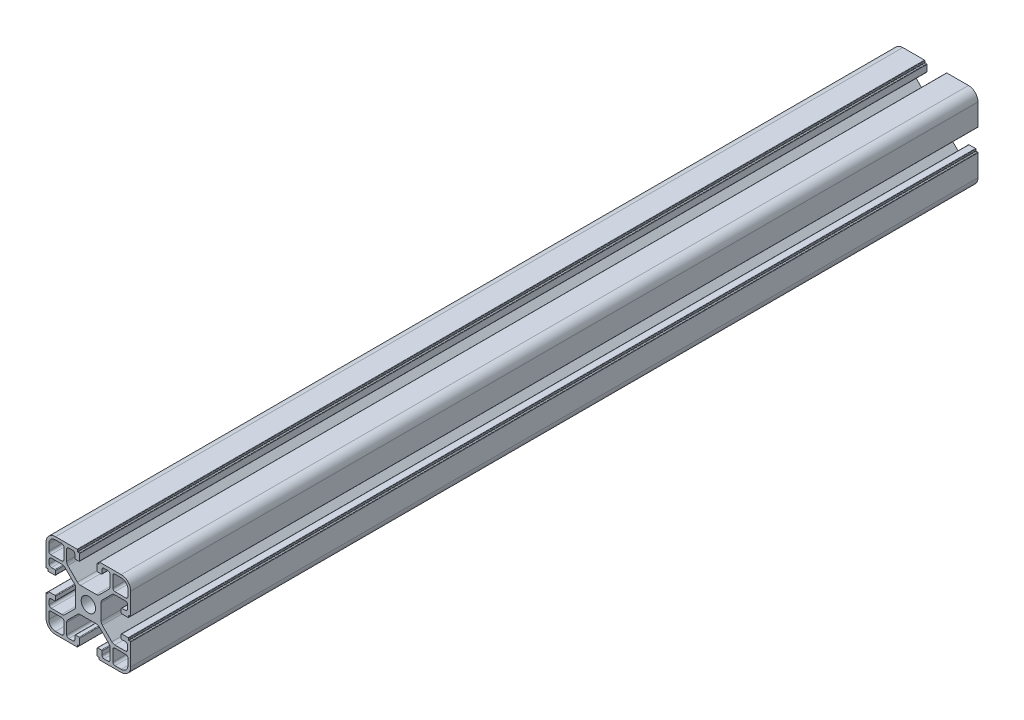
from build123d import *

# Parameters (mm, degrees)
SKETCH2_R           = 3.4
BOSS_EXTRUDE1_DEPTH = 400


with BuildPart() as part:
    # Sketch2 → Boss-Extrude1 (new body)
    with BuildSketch(Plane.XY):
        with BuildLine():
            Line((4.5, 0), (14.7, 0))
            ThreePointArc((14.7, 0), (14.841421356, 0.058578644), (14.9, 0.2))
            Line((14.9, 0.2), (14.9, 0.8))
            ThreePointArc((14.9, 0.8), (14.958578644, 0.941421356), (15.1, 1))
            Line((15.1, 1), (15.7, 1))
            ThreePointArc((15.7, 1), (15.841421356, 1.058578644), (15.9, 1.2))
            Line((15.9, 1.2), (15.9, 4.2))
            ThreePointArc((15.9, 4.2), (15.812132034, 4.412132034), (15.6, 4.5))
            Line((15.6, 4.5), (13.9, 4.5))
            ThreePointArc((13.9, 4.5), (13.687867966, 4.412132034), (13.6, 4.2))
            Line((13.6, 4.2), (13.6, 2.5))
            ThreePointArc((13.6, 2.5), (13.307106781, 1.792893219), (12.6, 1.5))
            Line((12.6, 1.5), (10.75, 1.5))
            ThreePointArc((10.75, 1.5), (10.042893219, 1.792893219), (9.75, 2.5))
            Line((9.75, 2.5), (9.75, 7.507359313))
            ThreePointArc((9.75, 7.507359313), (9.902240935, 8.272726178), (10.335786438, 8.921572875))
            Line((10.335786438, 8.921572875), (14.828427125, 13.414213562))
            ThreePointArc((14.828427125, 13.414213562), (15.477273822, 13.847759065), (16.242640687, 14))
            Line((16.242640687, 14), (23.757359313, 14))
            ThreePointArc((23.757359313, 14), (24.522726178, 13.847759065), (25.171572875, 13.414213562))
            Line((25.171572875, 13.414213562), (29.664213562, 8.921572875))
            ThreePointArc((29.664213562, 8.921572875), (30.097759065, 8.272726178), (30.25, 7.507359313))
            Line((30.25, 7.507359313), (30.25, 2.5))
            ThreePointArc((30.25, 2.5), (29.957106781, 1.792893219), (29.25, 1.5))
            Line((29.25, 1.5), (27.4, 1.5))
            ThreePointArc((27.4, 1.5), (26.692893219, 1.792893219), (26.4, 2.5))
            Line((26.4, 2.5), (26.4, 4.2))
            ThreePointArc((26.4, 4.2), (26.312132034, 4.412132034), (26.1, 4.5))
            Line((26.1, 4.5), (24.4, 4.5))
            ThreePointArc((24.4, 4.5), (24.187867966, 4.412132034), (24.1, 4.2))
            Line((24.1, 4.2), (24.1, 1.2))
            ThreePointArc((24.1, 1.2), (24.158578644, 1.058578644), (24.3, 1))
            Line((24.3, 1), (24.9, 1))
            ThreePointArc((24.9, 1), (25.041421356, 0.941421356), (25.1, 0.8))
            Line((25.1, 0.8), (25.1, 0.2))
            ThreePointArc((25.1, 0.2), (25.158578644, 0.058578644), (25.3, 0))
            Line((25.3, 0), (35.5, 0))
            ThreePointArc((35.5, 0), (38.681980515, 1.318019485), (40, 4.5))
            Line((40, 4.5), (40, 14.7))
            ThreePointArc((40, 14.7), (39.941421356, 14.841421356), (39.8, 14.9))
            Line((39.8, 14.9), (39.2, 14.9))
            ThreePointArc((39.2, 14.9), (39.058578644, 14.958578644), (39, 15.1))
            Line((39, 15.1), (39, 15.7))
            ThreePointArc((39, 15.7), (38.941421356, 15.841421356), (38.8, 15.9))
            Line((38.8, 15.9), (35.8, 15.9))
            ThreePointArc((35.8, 15.9), (35.587867966, 15.812132034), (35.5, 15.6))
            Line((35.5, 15.6), (35.5, 13.9))
            ThreePointArc((35.5, 13.9), (35.587867966, 13.687867966), (35.8, 13.6))
            Line((35.8, 13.6), (37.5, 13.6))
            ThreePointArc((37.5, 13.6), (38.207106781, 13.307106781), (38.5, 12.6))
            Line((38.5, 12.6), (38.5, 10.75))
            ThreePointArc((38.5, 10.75), (38.207106781, 10.042893219), (37.5, 9.75))
            Line((37.5, 9.75), (32.492640687, 9.75))
            ThreePointArc((32.492640687, 9.75), (31.727273822, 9.902240935), (31.078427125, 10.335786438))
            Line((31.078427125, 10.335786438), (26.585786438, 14.828427125))
            ThreePointArc((26.585786438, 14.828427125), (26.152240935, 15.477273822), (26, 16.242640687))
            Line((26, 16.242640687), (26, 23.757359313))
            ThreePointArc((26, 23.757359313), (26.152240935, 24.522726178), (26.585786438, 25.171572875))
            Line((26.585786438, 25.171572875), (31.078427125, 29.664213562))
            ThreePointArc((31.078427125, 29.664213562), (31.727273822, 30.097759065), (32.492640687, 30.25))
            Line((32.492640687, 30.25), (37.5, 30.25))
            ThreePointArc((37.5, 30.25), (38.207106781, 29.957106781), (38.5, 29.25))
            Line((38.5, 29.25), (38.5, 27.4))
            ThreePointArc((38.5, 27.4), (38.207106781, 26.692893219), (37.5, 26.4))
            Line((37.5, 26.4), (35.8, 26.4))
            ThreePointArc((35.8, 26.4), (35.587867966, 26.312132034), (35.5, 26.1))
            Line((35.5, 26.1), (35.5, 24.4))
            ThreePointArc((35.5, 24.4), (35.587867966, 24.187867966), (35.8, 24.1))
            Line((35.8, 24.1), (38.8, 24.1))
            ThreePointArc((38.8, 24.1), (38.941421356, 24.158578644), (39, 24.3))
            Line((39, 24.3), (39, 24.9))
            ThreePointArc((39, 24.9), (39.058578644, 25.041421356), (39.2, 25.1))
            Line((39.2, 25.1), (39.8, 25.1))
            ThreePointArc((39.8, 25.1), (39.941421356, 25.158578644), (40, 25.3))
            Line((40, 25.3), (40, 35.5))
            ThreePointArc((40, 35.5), (38.681980515, 38.681980515), (35.5, 40))
            Line((35.5, 40), (25.3, 40))
            ThreePointArc((25.3, 40), (25.158578644, 39.941421356), (25.1, 39.8))
            Line((25.1, 39.8), (25.1, 39.2))
            ThreePointArc((25.1, 39.2), (25.041421356, 39.058578644), (24.9, 39))
            Line((24.9, 39), (24.3, 39))
            ThreePointArc((24.3, 39), (24.158578644, 38.941421356), (24.1, 38.8))
            Line((24.1, 38.8), (24.1, 35.8))
            ThreePointArc((24.1, 35.8), (24.187867966, 35.587867966), (24.4, 35.5))
            Line((24.4, 35.5), (26.1, 35.5))
            ThreePointArc((26.1, 35.5), (26.312132034, 35.587867966), (26.4, 35.8))
            Line((26.4, 35.8), (26.4, 37.5))
            ThreePointArc((26.4, 37.5), (26.692893219, 38.207106781), (27.4, 38.5))
            Line((27.4, 38.5), (29.25, 38.5))
            ThreePointArc((29.25, 38.5), (29.957106781, 38.207106781), (30.25, 37.5))
            Line((30.25, 37.5), (30.25, 32.492640687))
            ThreePointArc((30.25, 32.492640687), (30.097759065, 31.727273822), (29.664213562, 31.078427125))
            Line((29.664213562, 31.078427125), (25.171572875, 26.585786438))
            ThreePointArc((25.171572875, 26.585786438), (24.522726178, 26.152240935), (23.757359313, 26))
            Line((23.757359313, 26), (16.242640687, 26))
            ThreePointArc((16.242640687, 26), (15.477273822, 26.152240935), (14.828427125, 26.585786438))
            Line((14.828427125, 26.585786438), (10.335786438, 31.078427125))
            ThreePointArc((10.335786438, 31.078427125), (9.902240935, 31.727273822), (9.75, 32.492640687))
            Line((9.75, 32.492640687), (9.75, 37.5))
            ThreePointArc((9.75, 37.5), (10.042893219, 38.207106781), (10.75, 38.5))
            Line((10.75, 38.5), (12.6, 38.5))
            ThreePointArc((12.6, 38.5), (13.307106781, 38.207106781), (13.6, 37.5))
            Line((13.6, 37.5), (13.6, 35.8))
            ThreePointArc((13.6, 35.8), (13.687867966, 35.587867966), (13.9, 35.5))
            Line((13.9, 35.5), (15.6, 35.5))
            ThreePointArc((15.6, 35.5), (15.812132034, 35.587867966), (15.9, 35.8))
            Line((15.9, 35.8), (15.9, 38.8))
            ThreePointArc((15.9, 38.8), (15.841421356, 38.941421356), (15.7, 39))
            Line((15.7, 39), (15.1, 39))
            ThreePointArc((15.1, 39), (14.958578644, 39.058578644), (14.9, 39.2))
            Line((14.9, 39.2), (14.9, 39.8))
            ThreePointArc((14.9, 39.8), (14.841421356, 39.941421356), (14.7, 40))
            Line((14.7, 40), (4.5, 40))
            ThreePointArc((4.5, 40), (1.318019485, 38.681980515), (0, 35.5))
            Line((0, 35.5), (0, 25.3))
            ThreePointArc((0, 25.3), (0.058578644, 25.158578644), (0.2, 25.1))
            Line((0.2, 25.1), (0.8, 25.1))
            ThreePointArc((0.8, 25.1), (0.941421356, 25.041421356), (1, 24.9))
            Line((1, 24.9), (1, 24.3))
            ThreePointArc((1, 24.3), (1.058578644, 24.158578644), (1.2, 24.1))
            Line((1.2, 24.1), (4.2, 24.1))
            ThreePointArc((4.2, 24.1), (4.412132034, 24.187867966), (4.5, 24.4))
            Line((4.5, 24.4), (4.5, 26.1))
            ThreePointArc((4.5, 26.1), (4.412132034, 26.312132034), (4.2, 26.4))
            Line((4.2, 26.4), (2.5, 26.4))
            ThreePointArc((2.5, 26.4), (1.792893219, 26.692893219), (1.5, 27.4))
            Line((1.5, 27.4), (1.5, 29.25))
            ThreePointArc((1.5, 29.25), (1.792893219, 29.957106781), (2.5, 30.25))
            Line((2.5, 30.25), (7.507359313, 30.25))
            ThreePointArc((7.507359313, 30.25), (8.272726178, 30.097759065), (8.921572875, 29.664213562))
            Line((8.921572875, 29.664213562), (13.414213562, 25.171572875))
            ThreePointArc((13.414213562, 25.171572875), (13.847759065, 24.522726178), (14, 23.757359313))
            Line((14, 23.757359313), (14, 16.242640687))
            ThreePointArc((14, 16.242640687), (13.847759065, 15.477273822), (13.414213562, 14.828427125))
            Line((13.414213562, 14.828427125), (8.921572875, 10.335786438))
            ThreePointArc((8.921572875, 10.335786438), (8.272726178, 9.902240935), (7.507359313, 9.75))
            Line((7.507359313, 9.75), (2.5, 9.75))
            ThreePointArc((2.5, 9.75), (1.792893219, 10.042893219), (1.5, 10.75))
            Line((1.5, 10.75), (1.5, 12.6))
            ThreePointArc((1.5, 12.6), (1.792893219, 13.307106781), (2.5, 13.6))
            Line((2.5, 13.6), (4.2, 13.6))
            ThreePointArc((4.2, 13.6), (4.412132034, 13.687867966), (4.5, 13.9))
            Line((4.5, 13.9), (4.5, 15.6))
            ThreePointArc((4.5, 15.6), (4.412132034, 15.812132034), (4.2, 15.9))
            Line((4.2, 15.9), (1.2, 15.9))
            ThreePointArc((1.2, 15.9), (1.058578644, 15.841421356), (1, 15.7))
            Line((1, 15.7), (1, 15.1))
            ThreePointArc((1, 15.1), (0.941421356, 14.958578644), (0.8, 14.9))
            Line((0.8, 14.9), (0.2, 14.9))
            ThreePointArc((0.2, 14.9), (0.058578644, 14.841421356), (0, 14.7))
            Line((0, 14.7), (0, 4.5))
            ThreePointArc((0, 4.5), (1.318019485, 1.318019485), (4.5, 0))
        make_face()
        with Locations((20, 20)):
            Circle(SKETCH2_R, mode=Mode.SUBTRACT)
        with BuildLine():
            Line((31.55, 37.7), (31.55, 32.55))
            ThreePointArc((31.55, 32.55), (31.842893219, 31.842893219), (32.55, 31.55))
            Line((32.55, 31.55), (37.7, 31.55))
            ThreePointArc((37.7, 31.55), (38.407106781, 31.842893219), (38.7, 32.55))
            Line((38.7, 32.55), (38.7, 35.5))
            ThreePointArc((38.7, 35.5), (37.7627417, 37.7627417), (35.5, 38.7))
            Line((35.5, 38.7), (32.55, 38.7))
            ThreePointArc((32.55, 38.7), (31.842893219, 38.407106781), (31.55, 37.7))
        make_face(mode=Mode.SUBTRACT)
        with BuildLine():
            Line((1.3, 35.5), (1.3, 32.55))
            ThreePointArc((1.3, 32.55), (1.592893219, 31.842893219), (2.3, 31.55))
            Line((2.3, 31.55), (7.45, 31.55))
            ThreePointArc((7.45, 31.55), (8.157106781, 31.842893219), (8.45, 32.55))
            Line((8.45, 32.55), (8.45, 37.7))
            ThreePointArc((8.45, 37.7), (8.157106781, 38.407106781), (7.45, 38.7))
            Line((7.45, 38.7), (4.5, 38.7))
            ThreePointArc((4.5, 38.7), (2.2372583, 37.7627417), (1.3, 35.5))
        make_face(mode=Mode.SUBTRACT)
        with BuildLine():
            Line((1.3, 7.45), (1.3, 4.5))
            ThreePointArc((1.3, 4.5), (2.2372583, 2.2372583), (4.5, 1.3))
            Line((4.5, 1.3), (7.45, 1.3))
            ThreePointArc((7.45, 1.3), (8.157106781, 1.592893219), (8.45, 2.3))
            Line((8.45, 2.3), (8.45, 7.45))
            ThreePointArc((8.45, 7.45), (8.157106781, 8.157106781), (7.45, 8.45))
            Line((7.45, 8.45), (2.3, 8.45))
            ThreePointArc((2.3, 8.45), (1.592893219, 8.157106781), (1.3, 7.45))
        make_face(mode=Mode.SUBTRACT)
        with BuildLine():
            Line((31.55, 7.45), (31.55, 2.3))
            ThreePointArc((31.55, 2.3), (31.842893219, 1.592893219), (32.55, 1.3))
            Line((32.55, 1.3), (35.5, 1.3))
            ThreePointArc((35.5, 1.3), (37.7627417, 2.2372583), (38.7, 4.5))
            Line((38.7, 4.5), (38.7, 7.45))
            ThreePointArc((38.7, 7.45), (38.407106781, 8.157106781), (37.7, 8.45))
            Line((37.7, 8.45), (32.55, 8.45))
            ThreePointArc((32.55, 8.45), (31.842893219, 8.157106781), (31.55, 7.45))
        make_face(mode=Mode.SUBTRACT)
    extrude(amount=BOSS_EXTRUDE1_DEPTH)


solid = part.part
